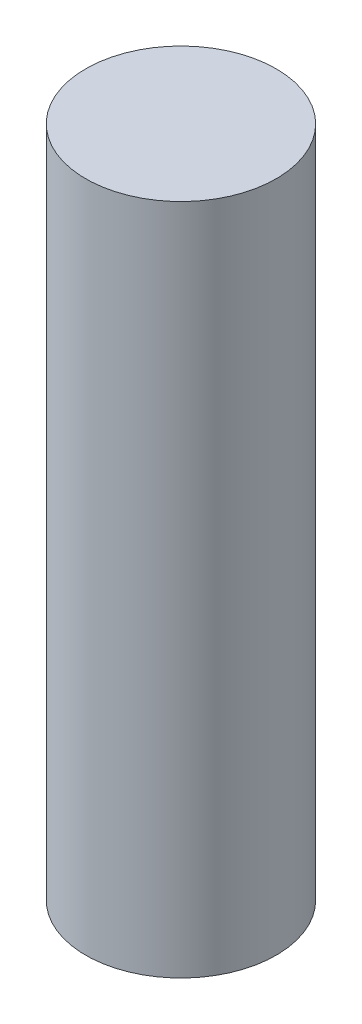
from build123d import *

# Parameters (mm, degrees)
SKETCH1_R           = 10.795
BOSS_EXTRUDE1_DEPTH = 76.2


with BuildPart() as part:
    # Sketch1 → Boss-Extrude1 (new body)
    with BuildSketch(Plane(origin=(0, 0, 0), x_dir=(1, 0, 0), z_dir=(0, 1, 0))):
        with Locations(Location((0, 0, 0), (0, 0, 90))):
            Circle(SKETCH1_R)
    extrude(amount=BOSS_EXTRUDE1_DEPTH)


solid = part.part
